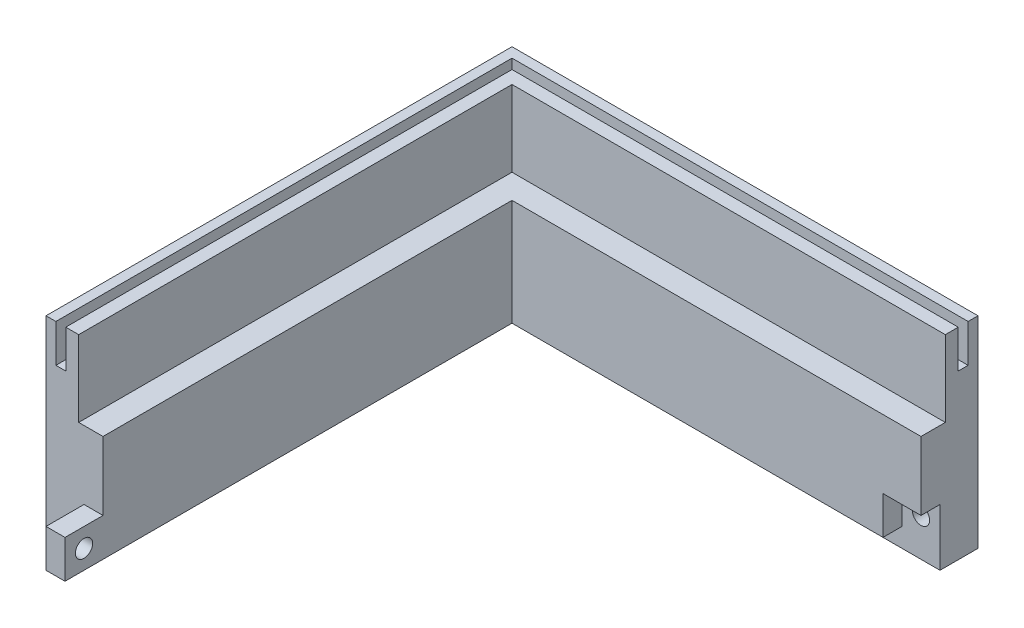
from build123d import *

# Parameters (mm, degrees)
BOSS_EXTRUDE5_DEPTH = 67.31
CUT_EXTRUDE2_DEPTH  = 12.693340834
CUT_EXTRUDE3_DEPTH  = 25.4
CUT_EXTRUDE5_DEPTH  = 6.35
SKETCH16_W          = 6.35
SKETCH16_H          = 12.7
BOSS_EXTRUDE6_DEPTH = 12.7
SKETCH17_W          = 6.35
SKETCH17_H          = 12.7
CUT_EXTRUDE6_DEPTH  = 12.7
SKETCH18_R          = 2.8829
CUT_EXTRUDE7_DEPTH  = 12.7
SKETCH19_R          = 2.8829
CUT_EXTRUDE8_DEPTH  = 4.826
SKETCH21_R          = 2.8829
CUT_EXTRUDE9_DEPTH  = 4.826


with BuildPart() as part:
    # Sketch1 → Boss-Extrude5 (new body)
    with BuildSketch(Plane(origin=(0, 0, 0), x_dir=(1, 0, 0), z_dir=(0, 1, 0))):
        Polygon((-60.605605599, 37.663504972), (95.096394401, 37.663504972), (95.096394401, 18.613504972), (-41.555605599, 18.613504972), (-41.555605599, -118.038495028), (-60.605605599, -118.038495028), align=None)
    extrude(amount=BOSS_EXTRUDE5_DEPTH)

    # Sketch8 → Cut-Extrude2 (cut)
    with BuildSketch(Plane(origin=(0, 67.31, 0), x_dir=(1, 0, 0), z_dir=(0, 1, 0))):
        Polygon((-57.303605599, -118.038495028), (-57.303605599, 34.361504972), (95.096394401, 34.361504972), (95.096394401, 31.059504972), (-54.001605599, 31.059504972), (-54.001605599, -118.038495028), align=None)
    extrude(amount=-CUT_EXTRUDE2_DEPTH, mode=Mode.SUBTRACT)

    # Sketch9 → Cut-Extrude3 (cut)
    with BuildSketch(Plane(origin=(0, 67.31, 0), x_dir=(1, 0, 0), z_dir=(0, 1, 0))):
        Polygon((-49.683605599, -118.038495028), (-49.683605599, 26.741504972), (95.096394401, 26.741504972), (95.096394401, 18.613504972), (-41.555605599, 18.613504972), (-41.555605599, -118.038495028), align=None)
    extrude(amount=-CUT_EXTRUDE3_DEPTH, mode=Mode.SUBTRACT)

    # Sketch15 → Cut-Extrude5 (cut)
    with BuildSketch(Plane.XZ):
        Polygon((-41.555605599, 118.038495028), (-47.905605599, 118.038495028), (-47.905605599, -24.963504972), (95.096394401, -24.963504972), (95.096394401, -18.613504972), (-41.555605599, -18.613504972), align=None)
    extrude(amount=-CUT_EXTRUDE5_DEPTH, mode=Mode.SUBTRACT)

    # Sketch16 → Boss-Extrude6 (add)
    with BuildSketch(Plane.XY.offset(118.038495028)):
        with Locations((-44.730605599, 12.7)):
            Rectangle(SKETCH16_W, SKETCH16_H)
    extrude(amount=BOSS_EXTRUDE6_DEPTH)

    # Sketch17 → Cut-Extrude6 (cut)
    with BuildSketch(Plane(origin=(95.096394401, 0, 0), x_dir=(0, 0, -1), z_dir=(1, 0, 0))):
        with Locations((21.788504972, 12.7)):
            Rectangle(SKETCH17_W, SKETCH17_H)
    extrude(amount=-CUT_EXTRUDE6_DEPTH, mode=Mode.SUBTRACT)

    # Sketch18 → Cut-Extrude7 (cut)
    with BuildSketch(Plane(origin=(-41.555605599, 0, 0), x_dir=(0, 0, -1), z_dir=(1, 0, 0))):
        with Locations((-124.388495028, 12.7)):
            Circle(SKETCH18_R)
    extrude(amount=-CUT_EXTRUDE7_DEPTH, mode=Mode.SUBTRACT)

    # Sketch19 → Cut-Extrude8 (cut)
    with BuildSketch(Plane.XY.offset(-24.963504972)):
        with Locations((88.746394401, 12.7)):
            Circle(SKETCH19_R)
    extrude(amount=-CUT_EXTRUDE8_DEPTH, mode=Mode.SUBTRACT)

    # Sketch21 → Cut-Extrude9 (cut)
    with BuildSketch(Plane.XZ.offset(-6.35)):
        with Locations(Location((-44.730605599, -21.788504972, 0), (0, 0, 270))):
            Circle(SKETCH21_R)
    extrude(amount=-CUT_EXTRUDE9_DEPTH, mode=Mode.SUBTRACT)


solid = part.part
